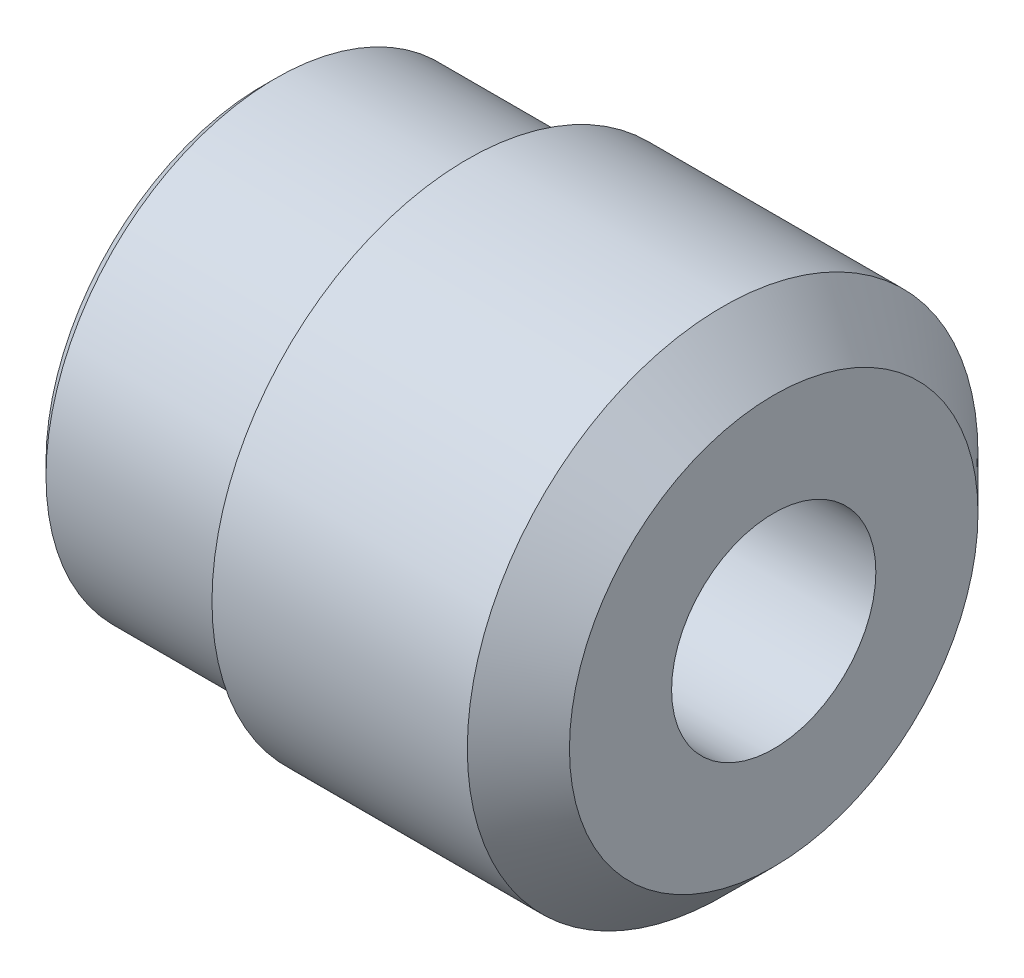
from build123d import *

# Parameters (mm, degrees)
CHANFREIN1_SIZE = 2
CHANFREIN2_SIZE = 0.5


with BuildPart() as part:
    # Esquisse1 → Base-Révolution (revolve)
    with BuildSketch(Plane.XY, mode=Mode.PRIVATE) as base_r_volution_sk:
        Polygon((0, 6), (0, 9), (8, 9), (8, 10), (20, 10), (20, 4), (14, 4), (14, 6), align=None)
    revolve(base_r_volution_sk.sketch.rotate(Axis((0, 0, 0), (1, 0, 0)), 90), axis=Axis((0, 0, 0), (1, 0, 0)))

    # Chanfrein1
    chanfrein1_edges = [part.edges().sort_by_distance(p)[0] for p in [
        (20, 0, -10),
    ]]
    chamfer(chanfrein1_edges, length=CHANFREIN1_SIZE)

    # Chanfrein2
    chanfrein2_edges = [part.edges().sort_by_distance(p)[0] for p in [
        (0, 0, -9),
    ]]
    chamfer(chanfrein2_edges, length=CHANFREIN2_SIZE)


solid = part.part
